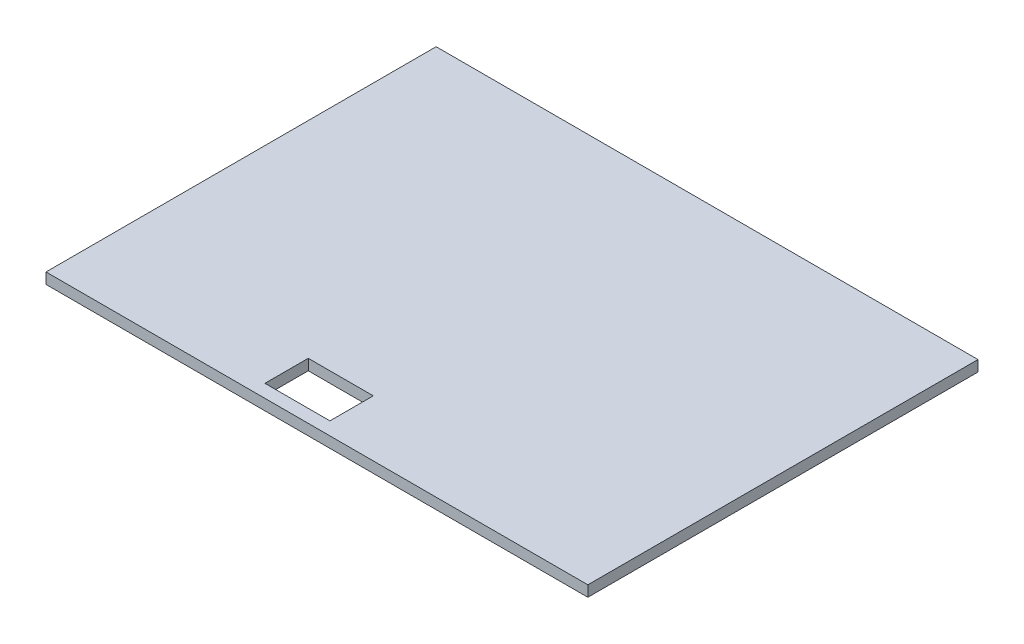
from build123d import *

# Parameters (mm, degrees)
SKETCH1_W           = 125
SKETCH1_H           = 90
SKETCH1_W_2         = 15
SKETCH1_H_2         = 10
BOSS_EXTRUDE1_DEPTH = 2.5


with BuildPart() as part:
    # Sketch1 → Boss-Extrude1 (new body)
    with BuildSketch(Plane(origin=(0, 0, 0), x_dir=(1, 0, 0), z_dir=(0, 1, 0))):
        Rectangle(SKETCH1_W, SKETCH1_H)
        with Locations((-7.5, -37)):
            Rectangle(SKETCH1_W_2, SKETCH1_H_2, mode=Mode.SUBTRACT)
    extrude(amount=BOSS_EXTRUDE1_DEPTH)


solid = part.part
